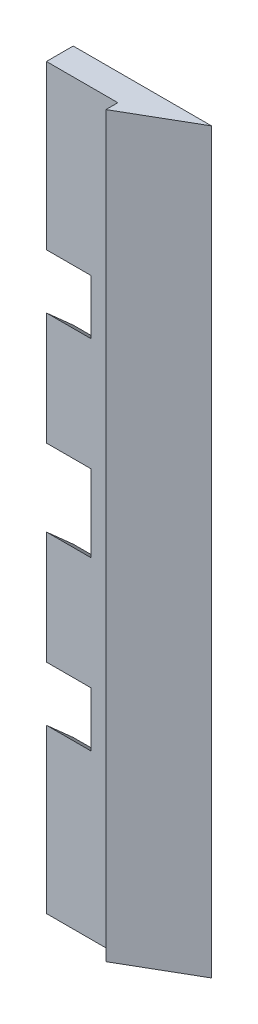
from build123d import *

# Parameters (mm, degrees)
BASE_DEPTH   = 99.2
JOIN_1_DEPTH = 6
CROQUIS3_W   = 9.6
CROQUIS3_H   = 99.2
JOIN_2_DEPTH = 0.4


with BuildPart() as part:
    # Croquis1 → BASE (new body)
    with BuildSketch(Plane(origin=(0, 0, 0), x_dir=(-1, 0, 0), z_dir=(0, 1, 0))):
        Polygon((0, 0), (-18.6, 0), (-9.6, 5.2), (-9.6, 4), (0, 4), align=None)
    extrude(amount=-BASE_DEPTH)

    # Croquis2 → JOIN_1 (cut)
    with BuildSketch(Plane(origin=(0, 0, 0), x_dir=(0, -1, 0), z_dir=(-1, 0, 0))):
        Polygon((18.35, -0.4), (21.925, 3.6), (29.275, 3.6), (32.85, -0.4), align=None)
        Polygon((40.85, -0.4), (44.425, 3.6), (54.775, 3.6), (58.35, -0.4), align=None)
        Polygon((69.925, 3.6), (66.35, -0.4), (80.85, -0.4), (77.275, 3.6), align=None)
    extrude(amount=-JOIN_1_DEPTH, mode=Mode.SUBTRACT)

    # Croquis3 → JOIN_2 (cut)
    with BuildSketch(Plane.XY.offset(4)):
        with Locations((4.8, -49.6)):
            Rectangle(CROQUIS3_W, CROQUIS3_H)
    extrude(amount=-JOIN_2_DEPTH, mode=Mode.SUBTRACT)


solid = part.part
